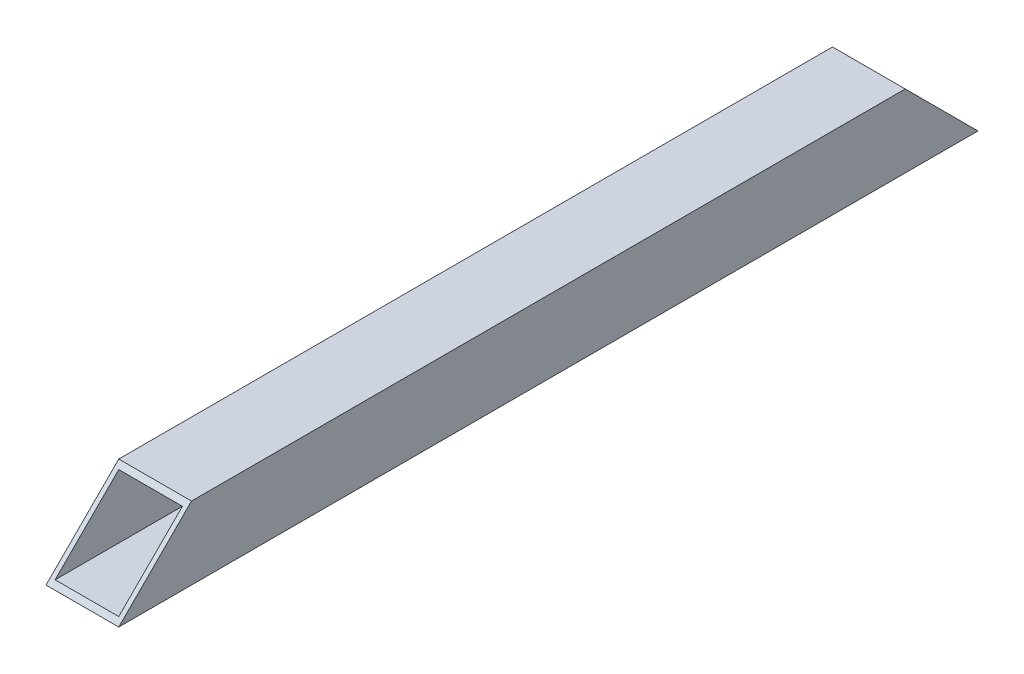
from build123d import *

# Parameters (mm, degrees)
SKETCH1_W           = 25.4
SKETCH1_H           = 25.4
SKETCH1_W_2         = 22.225
SKETCH1_H_2         = 22.225
BOSS_EXTRUDE1_DEPTH = 150
CUT_EXTRUDE1_DEPTH  = 153.66450144


with BuildPart() as part:
    # Sketch1 → Boss-Extrude1 (new, symmetric)
    with BuildSketch(Plane.XY):
        Rectangle(SKETCH1_W, SKETCH1_H)
        Rectangle(SKETCH1_W_2, SKETCH1_H_2, mode=Mode.SUBTRACT)
    extrude(amount=BOSS_EXTRUDE1_DEPTH, both=True)

    # Sketch2 → Cut-Extrude1 (cut, through all)
    with BuildSketch(Plane(origin=(12.7, 0, 0), x_dir=(0, 0, -1), z_dir=(1, 0, 0))):
        Polygon((-150, -12.7), (-150, 12.7), (-124.6, 12.7), align=None)
        Polygon((150, -12.7), (150, 12.7), (124.6, 12.7), align=None)
    extrude(amount=-CUT_EXTRUDE1_DEPTH, mode=Mode.SUBTRACT)


solid = part.part
